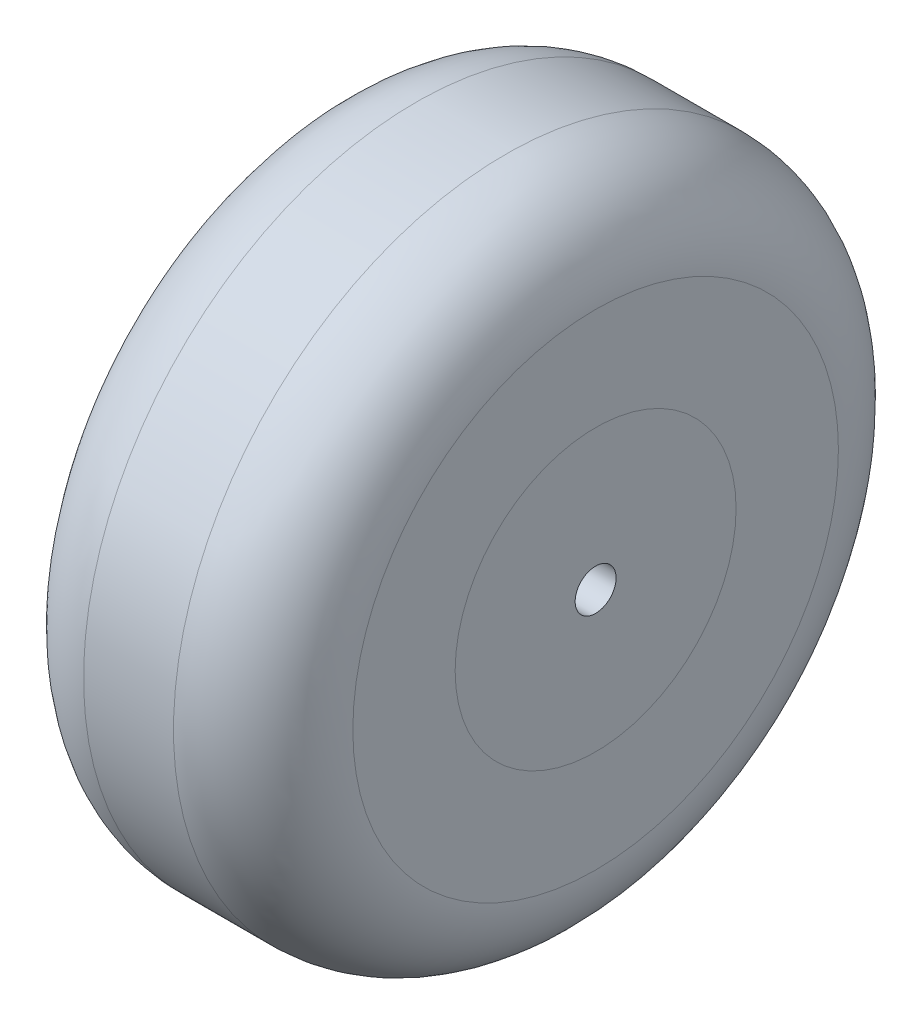
from build123d import *

# Parameters (mm, degrees)
SKETCH1_R           = 36.068
BOSS_EXTRUDE1_DEPTH = 29.21
FILLET1_R           = 9.7282
FILLET2_R           = 9.7282
SKETCH2_R           = 15.24
CUT_EXTRUDE1_DEPTH  = 59.779463659
SKETCH3_R           = 15.24
BOSS_EXTRUDE2_DEPTH = 29.21
SKETCH4_R           = 2.2225
CUT_EXTRUDE2_DEPTH  = 29.21


with BuildPart() as part:
    # Sketch1 → Boss-Extrude1 (new body)
    with BuildSketch(Plane(origin=(0, 0, 0), x_dir=(0, 0, -1), z_dir=(1, 0, 0))):
        with Locations(Location((0, 0, 0), (0, 0, 180))):
            Circle(SKETCH1_R)
    extrude(amount=BOSS_EXTRUDE1_DEPTH)

    # Fillet1
    fillet1_edges = [part.edges().sort_by_distance(p)[0] for p in [
        (29.21, 0, -36.068),
    ]]
    fillet(fillet1_edges, radius=FILLET1_R)

    # Fillet2
    fillet2_edges = [part.edges().sort_by_distance(p)[0] for p in [
        (0, 0, -36.068),
    ]]
    fillet(fillet2_edges, radius=FILLET2_R)

    # Sketch2 → Cut-Extrude1 (cut, through all)
    with BuildSketch(Plane(origin=(29.21, 0, 0), x_dir=(0, 0, -1), z_dir=(1, 0, 0))):
        Circle(SKETCH2_R)
    extrude(amount=-CUT_EXTRUDE1_DEPTH, mode=Mode.SUBTRACT)


with BuildPart() as body_2:
    # Sketch3 → Boss-Extrude2 (new body)
    with BuildSketch(Plane(origin=(29.21, 0, 0), x_dir=(0, 0, -1), z_dir=(1, 0, 0))):
        Circle(SKETCH3_R)
    extrude(amount=-BOSS_EXTRUDE2_DEPTH)

    # Sketch4 → Cut-Extrude2 (cut)
    with BuildSketch(Plane(origin=(29.21, 0, 0), x_dir=(0, 0, -1), z_dir=(1, 0, 0))):
        Circle(SKETCH4_R)
    extrude(amount=-CUT_EXTRUDE2_DEPTH, mode=Mode.SUBTRACT)


solid = Compound([part.part, body_2.part])
